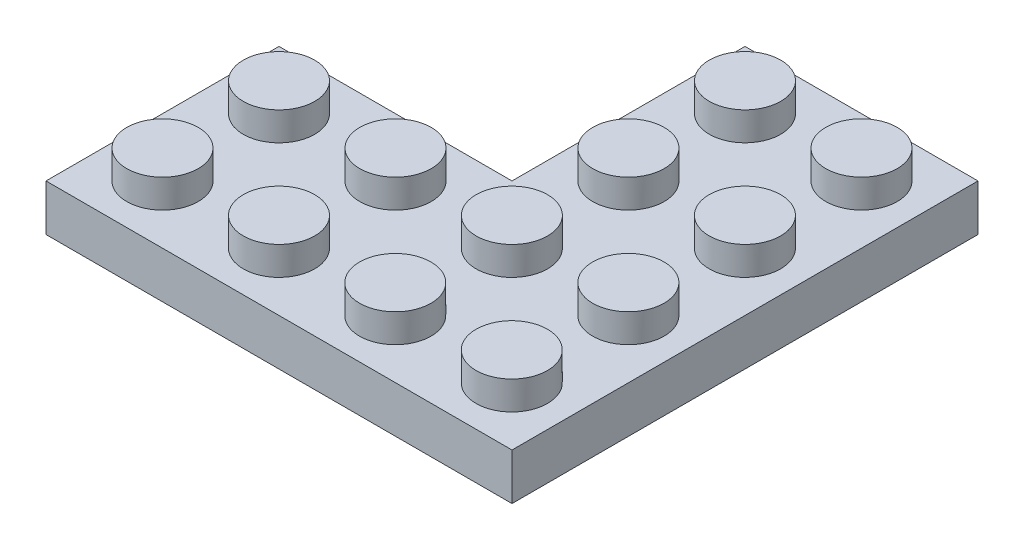
from build123d import *

# Parameters (mm, degrees)
BOSS_EXTRUDE1_DEPTH = 3.17
SKETCH3_R           = 2.44
BOSS_EXTRUDE2_DEPTH = 1.95
SHELL1_T            = -1.25
SKETCH4_R           = 3.15
SKETCH4_R_2         = 2.825
BOSS_EXTRUDE3_DEPTH = 1.65


with BuildPart() as part:
    # Sketch2 → Boss-Extrude1 (new body)
    with BuildSketch(Plane(origin=(0, 0, 0), x_dir=(1, 0, 0), z_dir=(0, 1, 0))):
        Polygon((0, 0), (-15.91, 0), (-15.91, -15.91), (15.91, -15.91), (15.91, 15.91), (0, 15.91), align=None)
    extrude(amount=-BOSS_EXTRUDE1_DEPTH)

    # Sketch3 → Boss-Extrude2 (add)
    with BuildSketch(Plane(origin=(0, 0, 0), x_dir=(1, 0, 0), z_dir=(0, 1, 0))):
        with Locations(Location((11.9325, 11.9325, 0), (0, 0, 90))):
            Circle(SKETCH3_R)
        with Locations(Location((11.9325, 3.9725, 0), (0, 0, 90))):
            Circle(SKETCH3_R)
        with Locations(Location((11.9325, -3.9875, 0), (0, 0, 90))):
            Circle(SKETCH3_R)
        with Locations(Location((11.9325, -11.9475, 0), (0, 0, 90))):
            Circle(SKETCH3_R)
        with Locations(Location((3.9775, 3.9725, 0), (0, 0, 90))):
            Circle(SKETCH3_R)
        with Locations(Location((3.9775, -3.9875, 0), (0, 0, 90))):
            Circle(SKETCH3_R)
        with Locations(Location((3.9775, -11.9475, 0), (0, 0, 90))):
            Circle(SKETCH3_R)
        with Locations(Location((3.9775, 11.9325, 0), (0, 0, 90))):
            Circle(SKETCH3_R)
        with Locations(Location((-11.93, -3.98, 0), (0, 0, 90))):
            Circle(SKETCH3_R)
        with Locations(Location((-3.975, -3.98, 0), (0, 0, 90))):
            Circle(SKETCH3_R)
        with Locations(Location((-3.975, -11.935, 0), (0, 0, 90))):
            Circle(SKETCH3_R)
        with Locations(Location((-11.93, -11.935, 0), (0, 0, 90))):
            Circle(SKETCH3_R)
    extrude(amount=BOSS_EXTRUDE2_DEPTH)

    # Shell1
    shell1_openings = [part.faces().sort_by_distance(p)[0] for p in [
        (2.651666667, -3.17, 2.651666667),
    ]]
    offset(amount=SHELL1_T, openings=shell1_openings, kind=Kind.INTERSECTION)

    # Sketch4 → Boss-Extrude3 (add)
    # profile 1 of 5: a face of its own
    with BuildSketch(Plane.XZ.offset(1.25)):
        with Locations(Location((-7.955, 7.955, 0), (0, 0, 270))):
            Circle(SKETCH4_R)
        with Locations(Location((-7.955, 7.955, 0), (0, 0, 270))):
            Circle(SKETCH4_R_2, mode=Mode.SUBTRACT)
    # profile 2 of 5: a face of its own
    with BuildSketch(Plane.XZ.offset(1.25)):
        with Locations(Location((0.005, 7.955, 0), (0, 0, 270))):
            Circle(SKETCH4_R)
        with Locations(Location((0.005, 7.955, 0), (0, 0, 270))):
            Circle(SKETCH4_R_2, mode=Mode.SUBTRACT)
    # profile 3 of 5: a face of its own
    with BuildSketch(Plane.XZ.offset(1.25)):
        with Locations(Location((7.965, 7.955, 0), (0, 0, 270))):
            Circle(SKETCH4_R)
        with Locations(Location((7.965, 7.955, 0), (0, 0, 270))):
            Circle(SKETCH4_R_2, mode=Mode.SUBTRACT)
    # profile 4 of 5: a face of its own
    with BuildSketch(Plane.XZ.offset(1.25)):
        with Locations(Location((7.965, -0.005, 0), (0, 0, 270))):
            Circle(SKETCH4_R)
        with Locations(Location((7.965, -0.005, 0), (0, 0, 270))):
            Circle(SKETCH4_R_2, mode=Mode.SUBTRACT)
    # profile 5 of 5: a face of its own
    with BuildSketch(Plane.XZ.offset(1.25)):
        with Locations(Location((7.965, -7.965, 0), (0, 0, 270))):
            Circle(SKETCH4_R)
        with Locations(Location((7.965, -7.965, 0), (0, 0, 270))):
            Circle(SKETCH4_R_2, mode=Mode.SUBTRACT)
    extrude(amount=BOSS_EXTRUDE3_DEPTH)


solid = part.part
